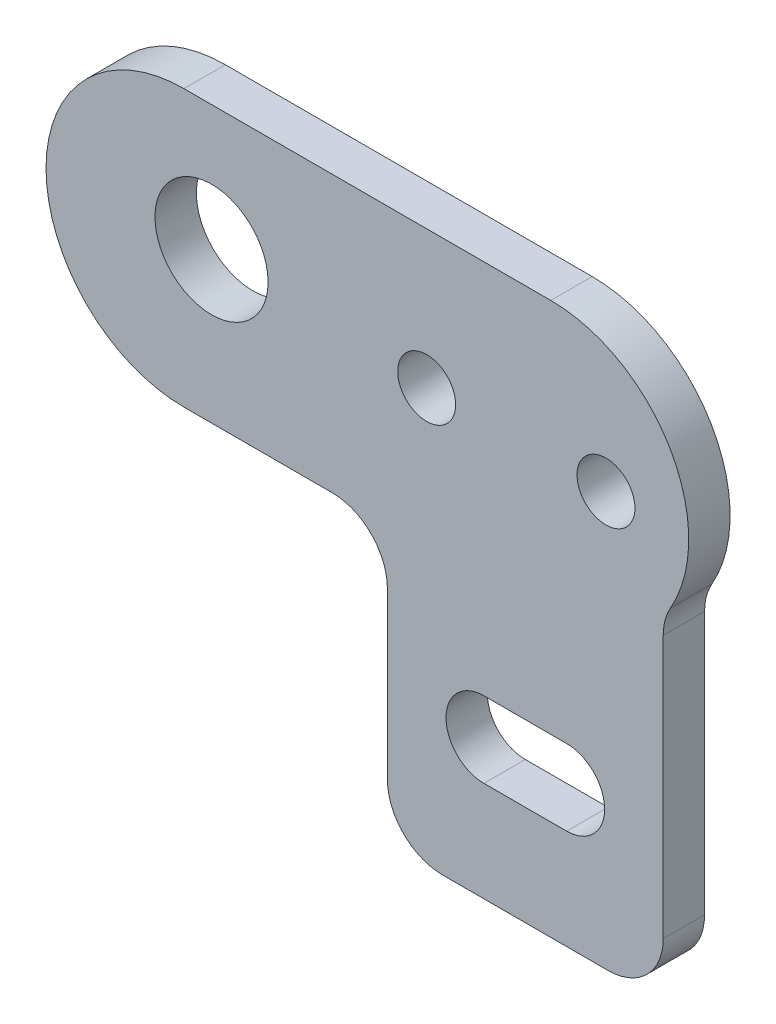
from build123d import *

# Parameters (mm, degrees)
BOSS_EXTRUDE1_DEPTH = 1.5
FILLET1_R           = 4
SKETCH2_R           = 4.1
SKETCH2_R_2         = 2.1
CUT_EXTRUDE1_DEPTH  = 39.103674364


with BuildPart() as part:
    # Sketch1 → Boss-Extrude1 (new, symmetric)
    with BuildSketch(Plane.XY):
        with BuildLine():
            Line((13.3, 10), (-13.3, 10))
            ThreePointArc((-13.3, 10), (-23.3, 0), (-13.3, -10))
            Line((-13.3, -10), (1.45, -10))
            Line((1.45, -10), (1.45, -30))
            Line((1.45, -30), (21.45, -30))
            Line((21.45, -30), (21.45, -5.794609564))
            ThreePointArc((21.45, -5.794609564), (22.186678109, 4.585515476), (13.3, 10))
        make_face()
    extrude(amount=BOSS_EXTRUDE1_DEPTH, both=True)

    # Fillet1
    fillet1_edges = [part.edges().sort_by_distance(p)[0] for p in [
        (21.45, -5.794609564, 0),
        (21.45, -30, 0),
        (1.45, -30, 0),
        (1.45, -10, 0),
    ]]
    fillet(fillet1_edges, radius=FILLET1_R)

    # Sketch2 → Cut-Extrude1 (cut, through all)
    with BuildSketch(Plane.XY.offset(1.5)):
        with Locations((-11.3, 0.9)):
            Circle(SKETCH2_R)
        with Locations((4.3, 0)):
            Circle(SKETCH2_R_2)
        with Locations((17.3, 0)):
            Circle(SKETCH2_R_2)
        with BuildLine():
            Line((8.45, -17.25), (14.45, -17.25))
            ThreePointArc((14.45, -17.25), (17.2, -20), (14.45, -22.75))
            Line((14.45, -22.75), (8.45, -22.75))
            ThreePointArc((8.45, -22.75), (5.7, -20), (8.45, -17.25))
        make_face()
    extrude(amount=-CUT_EXTRUDE1_DEPTH, mode=Mode.SUBTRACT)


solid = part.part
